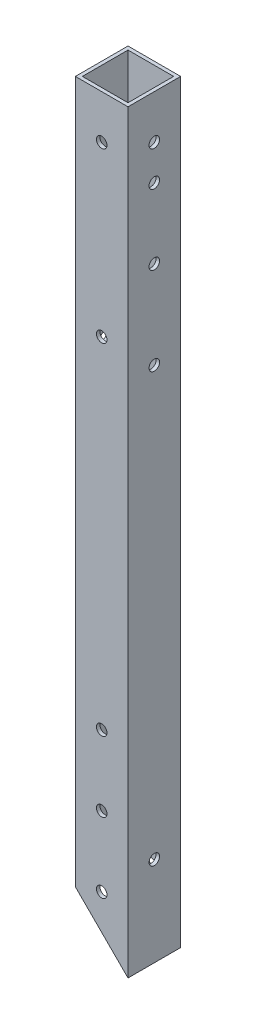
from build123d import *

# Parameters (mm, degrees)
SKETCH_1_W          = 15
SKETCH_1_H          = 15
SKETCH_1_W_2        = 13
SKETCH_1_H_2        = 13
EXTRUDE_1_DEPTH     = 215
SKETCH_2_R          = 1.5
CUT_EXTRUDE_1_DEPTH = 216.653077882
SKETCH_3_R          = 1.5
CUT_EXTRUDE_2_DEPTH = 216.653077882


with BuildPart() as part:
    # 草图1 → 凸台-拉伸1 (new body)
    with BuildSketch(Plane(origin=(0, 0, 0), x_dir=(1, 0, 0), z_dir=(0, 1, 0))):
        Rectangle(SKETCH_1_W, SKETCH_1_H)
        Rectangle(SKETCH_1_W_2, SKETCH_1_H_2, mode=Mode.SUBTRACT)
    extrude(amount=EXTRUDE_1_DEPTH)

    # 草图2 → 切除-拉伸1 (cut, through all)
    with BuildSketch(Plane.XY.offset(7.5)):
        with Locations((0, 37.5)):
            Circle(SKETCH_2_R)
        with Locations((0, 17.5)):
            Circle(SKETCH_2_R)
        with Locations((0, 57.5)):
            Circle(SKETCH_2_R)
        with Locations((0, 202.5)):
            Circle(SKETCH_2_R)
        with Locations((0, 154.5)):
            Circle(SKETCH_2_R)
        Polygon((7.5, 0), (-7.5, 0), (-7.5, 15), align=None)
    extrude(amount=-CUT_EXTRUDE_1_DEPTH, mode=Mode.SUBTRACT)

    # 草图3 → 切除-拉伸2 (cut, through all)
    with BuildSketch(Plane(origin=(7.5, 0, 0), x_dir=(0, 0, -1), z_dir=(1, 0, 0))):
        with Locations((0, 172.5)):
            Circle(SKETCH_3_R)
        with Locations((0, 192.5)):
            Circle(SKETCH_3_R)
        with Locations((0, 147.5)):
            Circle(SKETCH_3_R)
        with Locations((0, 202.5)):
            Circle(SKETCH_3_R)
        with Locations((0, 25.5)):
            Circle(SKETCH_3_R)
    extrude(amount=-CUT_EXTRUDE_2_DEPTH, mode=Mode.SUBTRACT)


solid = part.part
